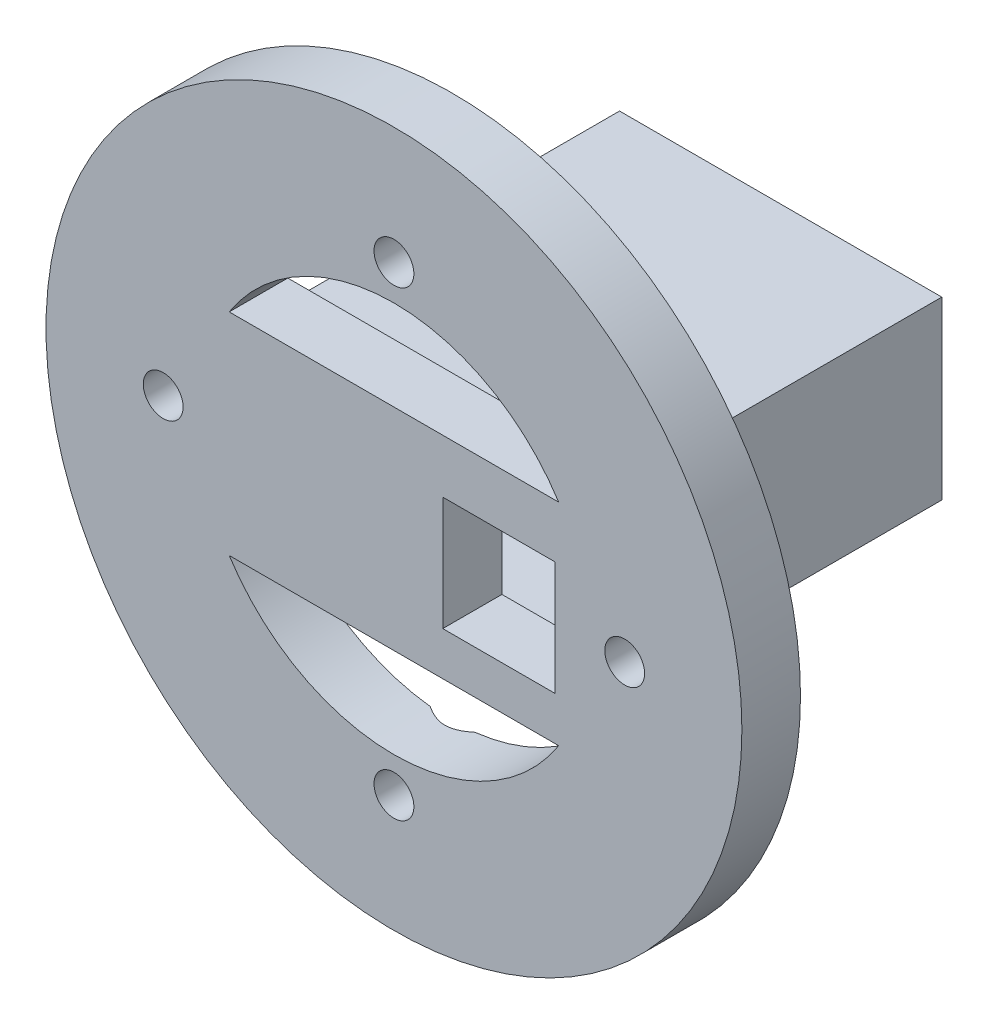
from build123d import *

# Parameters (mm, degrees)
SKETCH1_R                                       = 29.692527183
SKETCH1_R_2                                     = 22.692527183
SKETCH1_R_3                                     = 19.692527183
SKETCH1_R_4                                     = 16.692527183
BOSS_EXTRUDE1_DEPTH                             = 5
SKETCH9_W                                       = 27.5
SKETCH9_H                                       = 28
BOSS_EXTRUDE2_DEPTH                             = 7.5
SKETCH10_W                                      = 23.5
SKETCH10_H                                      = 25.45
CUT_EXTRUDE1_DEPTH                              = 6.1
SKETCH12_W                                      = 12
SKETCH12_H                                      = 11
CUT_EXTRUDE2_DEPTH                              = 3
CUT_EXTRUDE3_REACH                              = 55.407
SKETCH11_W                                      = 9.585282086
SKETCH11_H                                      = 9.717675131
CSK_FOR_M3_FLAT_HEAD_MACHINE_SCREW1_D           = 3.4
CSK_FOR_M3_FLAT_HEAD_MACHINE_SCREW1_DEPTH       = 12
CSK_FOR_M3_FLAT_HEAD_MACHINE_SCREW1_CSINK_D     = 7.3
CSK_FOR_M3_FLAT_HEAD_MACHINE_SCREW1_CSINK_ANGLE = 90
CSK_FOR_M3_FLAT_HEAD_MACHINE_SCREW1_TIP         = 1.021463052


with BuildPart() as part:
    # Sketch1 → Boss-Extrude1 (new body)
    # profile 1 of 4: a face of its own
    with BuildSketch(Plane(origin=(0, 0, 0), x_dir=(-1, 0, 0), z_dir=(0, 0, 1))):
        with Locations(Location((0, 0, 0), (0, 0, 180))):
            Circle(SKETCH1_R)
        Circle(SKETCH1_R_2, mode=Mode.SUBTRACT)
    # profile 2 of 4: a face of its own
    with BuildSketch(Plane(origin=(0, 0, 0), x_dir=(-1, 0, 0), z_dir=(0, 0, 1))):
        Circle(SKETCH1_R_2)
        Circle(SKETCH1_R_3, mode=Mode.SUBTRACT)
    # profile 3 of 4: a face of its own
    with BuildSketch(Plane(origin=(0, 0, 0), x_dir=(-1, 0, 0), z_dir=(0, 0, 1))):
        Circle(SKETCH1_R_3)
        Circle(SKETCH1_R_4, mode=Mode.SUBTRACT)
    # profile 4 of 4: a face of its own
    with BuildSketch(Plane(origin=(0, 0, 0), x_dir=(-1, 0, 0), z_dir=(0, 0, 1))):
        with BuildLine():
            Line((14.058465911, 9), (-14.058465911, 9))
            ThreePointArc((-14.058465911, 9), (-16.692527183, 0), (-14.058465911, -9))
            Line((-14.058465911, -9), (14.058465911, -9))
            ThreePointArc((14.058465911, -9), (16.020483578, -4.688770595), (16.692527183, 0))
            ThreePointArc((16.692527183, 0), (16.020483578, 4.688770595), (14.058465911, 9))
        make_face()
    extrude(amount=BOSS_EXTRUDE1_DEPTH)

    # Sketch9 → Boss-Extrude2 (add, symmetric)
    with BuildSketch(Plane(origin=(0, 0, 0), x_dir=(1, 0, 0), z_dir=(0, 1, 0))):
        with Locations((0, 14)):
            Rectangle(SKETCH9_W, SKETCH9_H)
    extrude(amount=BOSS_EXTRUDE2_DEPTH, both=True)

    # Sketch10 → Cut-Extrude1 (cut, symmetric)
    with BuildSketch(Plane(origin=(0, 0, 0), x_dir=(1, 0, 0), z_dir=(0, 1, 0))):
        with Locations((0, 12.775)):
            Rectangle(SKETCH10_W, SKETCH10_H)
    extrude(amount=CUT_EXTRUDE1_DEPTH, both=True, mode=Mode.SUBTRACT)

    # Sketch12 → Cut-Extrude2 (cut)
    with BuildSketch(Plane.XY.offset(-28)):
        with Locations((3.75, 0)):
            Rectangle(SKETCH12_W, SKETCH12_H)
    extrude(amount=CUT_EXTRUDE2_DEPTH, mode=Mode.SUBTRACT)

    # Cut-Extrude3: up to this face of the body (flat: up to its plane)
    cut_extrude3_end = Plane(part.part.faces().sort_by_distance((0, 0, -0.05))[0])
    # Sketch11 → Cut-Extrude3 (cut, up to the picked face)
    with BuildSketch(Plane.XY.offset(5), mode=Mode.PRIVATE) as cut_extrude3_sk1:
        with Locations((8.957358957, -0.433824782)):
            Rectangle(SKETCH11_W, SKETCH11_H)
    cut_extrude3_tool1 = split(extrude(cut_extrude3_sk1.sketch, amount=-CUT_EXTRUDE3_REACH, mode=Mode.PRIVATE), bisect_by=cut_extrude3_end, keep=Keep.BOTH, mode=Mode.PRIVATE)
    add(cut_extrude3_tool1.solids().sort_by(Axis((8.957359, -0.433825, 5), (0, 0, -1)))[0], mode=Mode.SUBTRACT)

    # CSK for M3 Flat Head Machine Screw1
    with Locations(Plane(origin=(0, 0, 0), x_dir=(1, 0, 0), z_dir=(0, 0, -1))):
        with Locations((-19.692527183, 0), (0, 19.692527183), (0, -19.692527183), (19.692527183, 0)):
            CounterSinkHole(CSK_FOR_M3_FLAT_HEAD_MACHINE_SCREW1_D / 2, CSK_FOR_M3_FLAT_HEAD_MACHINE_SCREW1_CSINK_D / 2, depth=CSK_FOR_M3_FLAT_HEAD_MACHINE_SCREW1_DEPTH, counter_sink_angle=CSK_FOR_M3_FLAT_HEAD_MACHINE_SCREW1_CSINK_ANGLE)
            with Locations((0, 0, -(CSK_FOR_M3_FLAT_HEAD_MACHINE_SCREW1_DEPTH + CSK_FOR_M3_FLAT_HEAD_MACHINE_SCREW1_TIP / 2))):  # 118° drill point
                Cone(0, CSK_FOR_M3_FLAT_HEAD_MACHINE_SCREW1_D / 2, CSK_FOR_M3_FLAT_HEAD_MACHINE_SCREW1_TIP, mode=Mode.SUBTRACT)


solid = part.part
